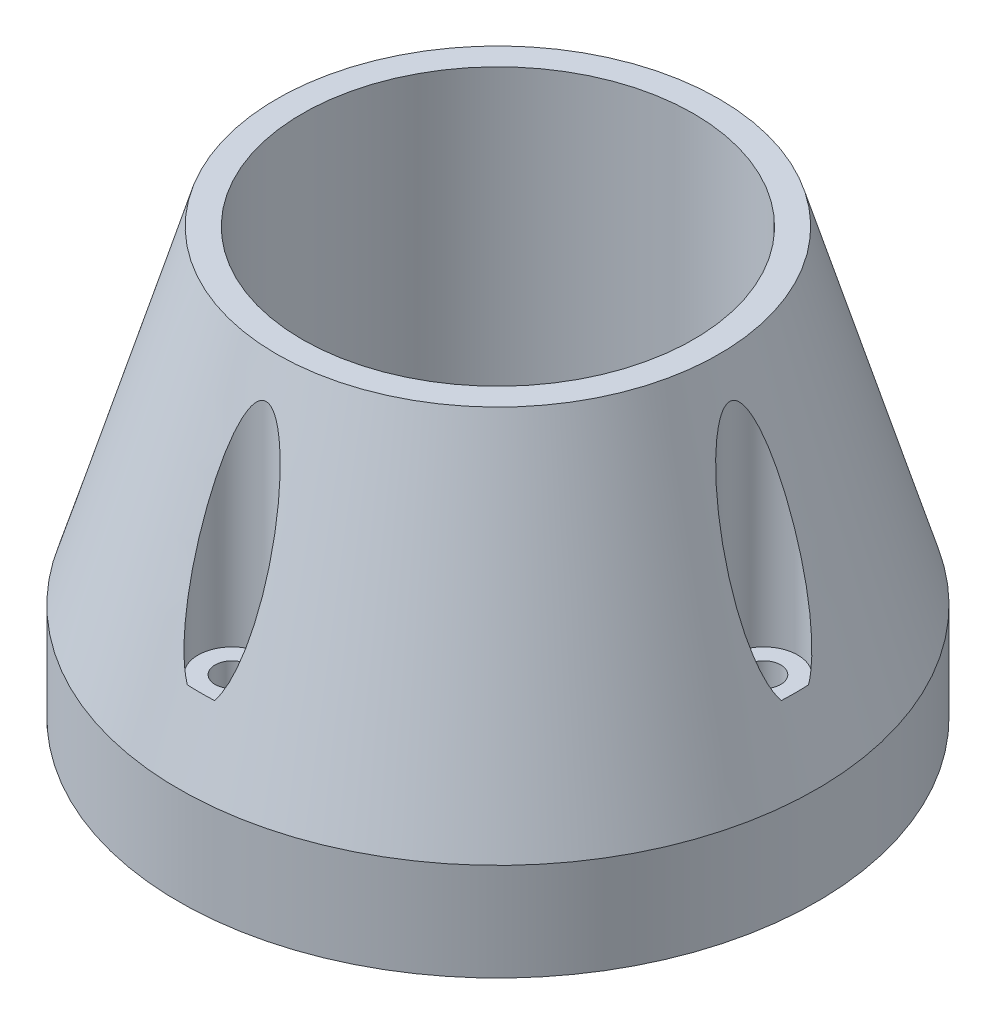
from build123d import *

# Parameters (mm, degrees)
SKETCH2_R          = 4
CUT_EXTRUDE1_DEPTH = 100
SKETCH3_R          = 8
CUT_EXTRUDE2_DEPTH = 60
SKETCH4_R          = 46
CUT_EXTRUDE3_DEPTH = 68.5
CUT_EXTRUDE5_DEPTH = 127.262623304
SKETCH6_R          = 7.5
CUT_EXTRUDE6_DEPTH = 127.262623304
CUT_EXTRUDE7_DEPTH = 127.262623304


with BuildPart() as part:
    # Sketch1 → Revolve1 (revolve)
    with BuildSketch(Plane.XY, mode=Mode.PRIVATE) as revolve1_sk:
        Polygon((0, 0), (0, 100), (-52, 100), (-75, 22.945205479), (-75, 0), align=None)
    revolve(revolve1_sk.sketch.rotate(Axis((0, 0, 0), (0, 1, 0)), 270), axis=Axis((0, 0, 0), (0, 1, 0)))

    # Sketch2 → Cut-Extrude1 (cut)
    with BuildSketch(Plane(origin=(0, 100, 0), x_dir=(1, 0, 0), z_dir=(0, 1, 0))):
        with Locations(Location((-62.5, 0, 0), (0, 0, 270))):
            Circle(SKETCH2_R)
        with Locations(Location((0, 62.5, 0), (0, 0, 270))):
            Circle(SKETCH2_R)
        with Locations(Location((62.5, 0, 0), (0, 0, 270))):
            Circle(SKETCH2_R)
        with Locations(Location((0, -62.5, 0), (0, 0, 270))):
            Circle(SKETCH2_R)
    extrude(amount=-CUT_EXTRUDE1_DEPTH, mode=Mode.SUBTRACT)

    # Sketch3 → Cut-Extrude2 (cut)
    with BuildSketch(Plane(origin=(0, 100, 0), x_dir=(1, 0, 0), z_dir=(0, 1, 0))):
        with Locations((0, 62.5)):
            Circle(SKETCH3_R)
        with Locations((62.5, 0)):
            Circle(SKETCH3_R)
        with Locations((0, -62.5)):
            Circle(SKETCH3_R)
        with Locations((-62.5, 0)):
            Circle(SKETCH3_R)
    extrude(amount=-CUT_EXTRUDE2_DEPTH, mode=Mode.SUBTRACT)

    # Sketch4 → Cut-Extrude3 (cut)
    with BuildSketch(Plane(origin=(0, 100, 0), x_dir=(1, 0, 0), z_dir=(0, 1, 0))):
        with Locations(Location((0, 0, 0), (0, 0, 270))):
            Circle(SKETCH4_R)
    extrude(amount=-CUT_EXTRUDE3_DEPTH, mode=Mode.SUBTRACT)

    # Sketch5 → Cut-Extrude5 (cut, through all)
    with BuildSketch(Plane(origin=(0, 31.5, 0), x_dir=(1, 0, 0), z_dir=(0, 1, 0))):
        with BuildLine():
            ThreePointArc((0, 17.5), (2.5, 20), (0, 22.5))
            ThreePointArc((0, 22.5), (-8.610377228, 20.787289482), (-15.909902577, 15.909902577))
            ThreePointArc((-15.909902577, 15.909902577), (-15.909902577, 12.374368671), (-12.374368671, 12.374368671))
            ThreePointArc((-12.374368671, 12.374368671), (-6.696960066, 16.167891819), (0, 17.5))
        make_face()
        with BuildLine():
            ThreePointArc((15.909902577, 15.909902577), (12.374368671, 15.909902577), (12.374368671, 12.374368671))
            ThreePointArc((12.374368671, 12.374368671), (16.167891819, 6.696960066), (17.5, 0))
            ThreePointArc((17.5, 0), (20, -2.5), (22.5, 0))
            ThreePointArc((22.5, 0), (20.787289482, 8.610377228), (15.909902577, 15.909902577))
        make_face()
        with BuildLine():
            ThreePointArc((15.909902577, -15.909902577), (15.909902577, -12.374368671), (12.374368671, -12.374368671))
            ThreePointArc((12.374368671, -12.374368671), (6.696960066, -16.167891819), (0, -17.5))
            ThreePointArc((0, -17.5), (-2.5, -20), (0, -22.5))
            ThreePointArc((0, -22.5), (8.610377228, -20.787289482), (15.909902577, -15.909902577))
        make_face()
        with BuildLine():
            ThreePointArc((-15.909902577, -15.909902577), (-12.374368671, -15.909902577), (-12.374368671, -12.374368671))
            ThreePointArc((-12.374368671, -12.374368671), (-16.167891819, -6.696960066), (-17.5, 0))
            ThreePointArc((-17.5, 0), (-20, 2.5), (-22.5, 0))
            ThreePointArc((-22.5, 0), (-20.787289482, -8.610377228), (-15.909902577, -15.909902577))
        make_face()
    extrude(amount=-CUT_EXTRUDE5_DEPTH, mode=Mode.SUBTRACT)

    # Sketch6 → Cut-Extrude6 (cut, through all)
    with BuildSketch(Plane(origin=(0, 31.5, 0), x_dir=(1, 0, 0), z_dir=(0, 1, 0))):
        with Locations(Location((0, 0, 0), (0, 0, 270))):
            Circle(SKETCH6_R)
    extrude(amount=-CUT_EXTRUDE6_DEPTH, mode=Mode.SUBTRACT)

    # Sketch7 → Cut-Extrude7 (cut, through all)
    with BuildSketch(Plane(origin=(0, 31.5, 0), x_dir=(1, 0, 0), z_dir=(0, 1, 0))):
        with BuildLine():
            ThreePointArc((44.764134431, 10.591141044), (38.747256662, 14.305596847), (35.032800859, 8.288719078))
            ThreePointArc((35.032800859, 8.288719078), (36, 0), (35.032800859, -8.288719078))
            ThreePointArc((35.032800859, -8.288719078), (38.747256662, -14.305596847), (44.764134431, -10.591141044))
            ThreePointArc((44.764134431, -10.591141044), (46, 0), (44.764134431, 10.591141044))
        make_face()
    extrude(amount=-CUT_EXTRUDE7_DEPTH, mode=Mode.SUBTRACT)


solid = part.part
